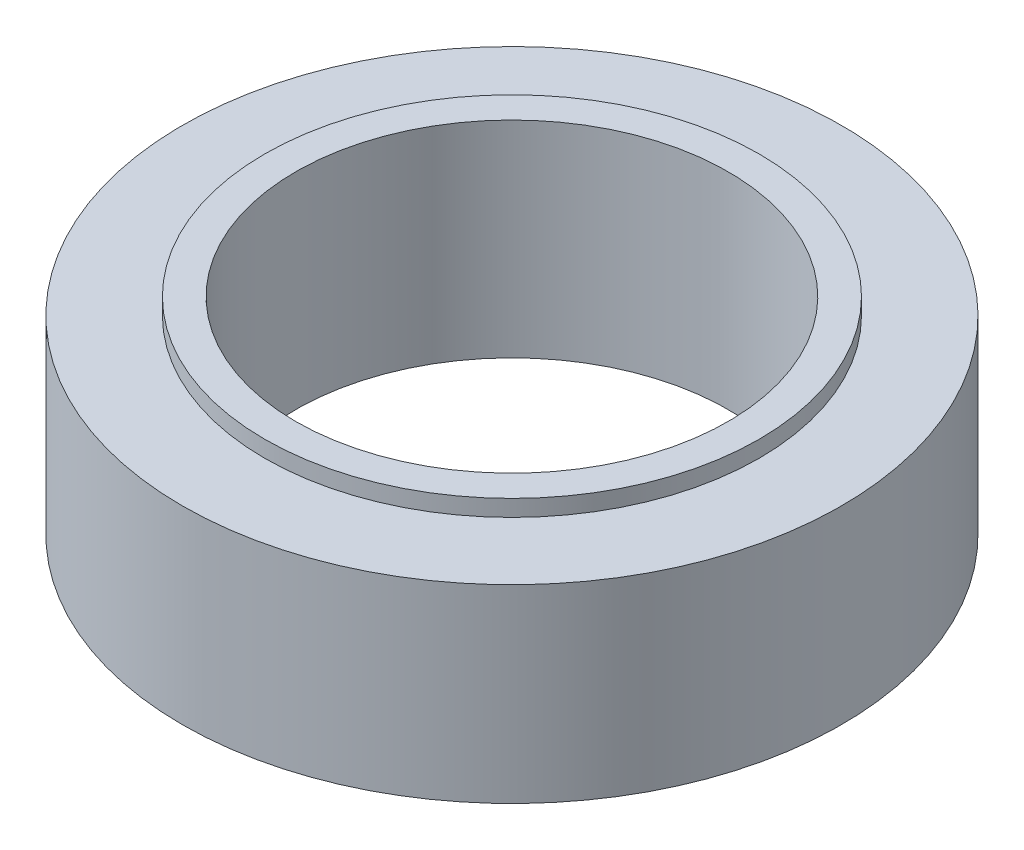
from build123d import *

# Parameters (mm, degrees)
CROQUIS1_R              = 4
CROQUIS1_R_2            = 2.625
SALIENTE_EXTRUIR1_DEPTH = 2.3
CROQUIS2_R              = 3
CROQUIS2_R_2            = 2.625
SALIENTE_EXTRUIR2_DEPTH = 0.2


with BuildPart() as part:
    # Croquis1 → Saliente-Extruir1 (new body)
    with BuildSketch(Plane(origin=(0, 0, 0), x_dir=(1, 0, 0), z_dir=(0, 1, 0))):
        with Locations(Location((0, 0, 0), (0, 0, 270))):
            Circle(CROQUIS1_R)
        with Locations(Location((0, 0, 0), (0, 0, 270))):
            Circle(CROQUIS1_R_2, mode=Mode.SUBTRACT)
    extrude(amount=SALIENTE_EXTRUIR1_DEPTH)

    # Croquis2 → Saliente-Extruir2 (add)
    with BuildSketch(Plane(origin=(0, 2.3, 0), x_dir=(1, 0, 0), z_dir=(0, 1, 0))):
        with Locations(Location((0, 0, 0), (0, 0, 270))):
            Circle(CROQUIS2_R)
        with Locations(Location((0, 0, 0), (0, 0, 270))):
            Circle(CROQUIS2_R_2, mode=Mode.SUBTRACT)
    extrude(amount=SALIENTE_EXTRUIR2_DEPTH)


solid = part.part
